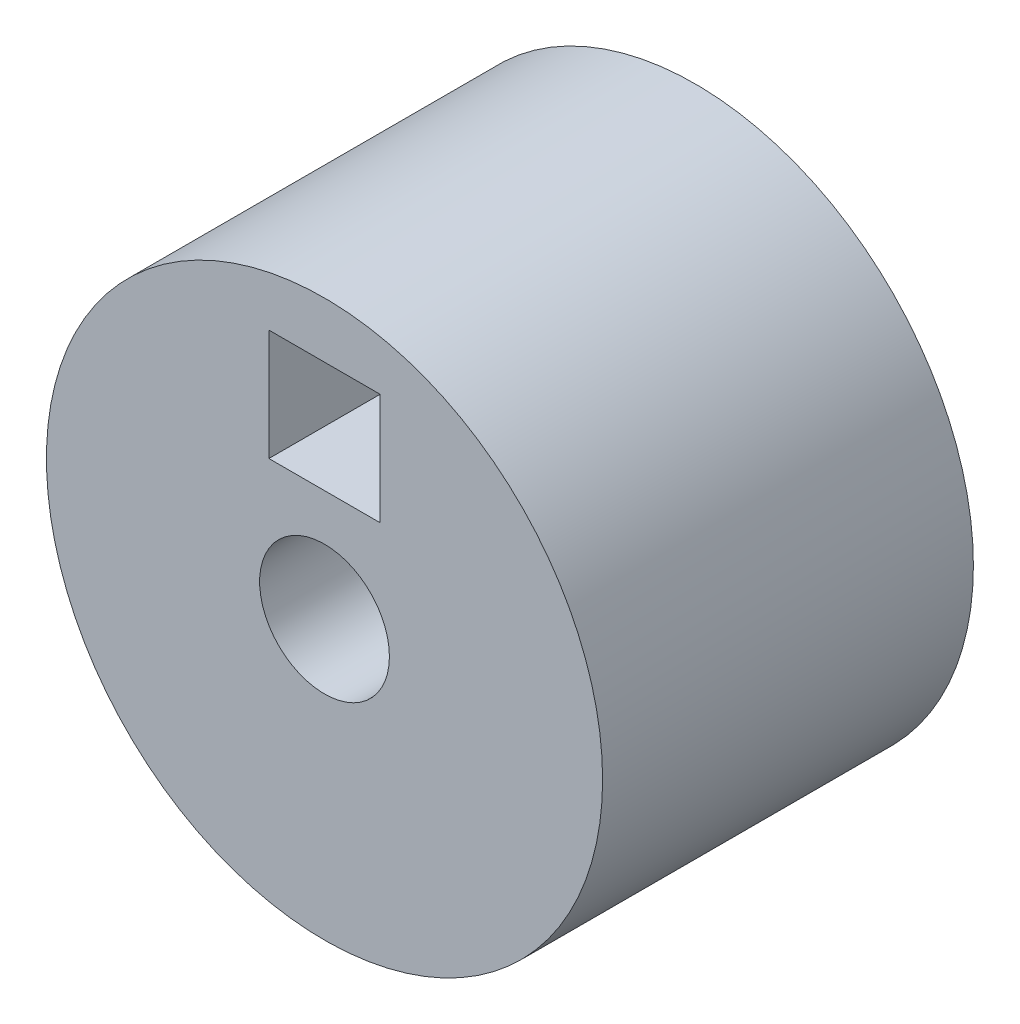
from build123d import *

# Parameters (mm, degrees)
SKETCH1_R           = 7.5
SKETCH1_R_2         = 1.75
BOSS_EXTRUDE1_DEPTH = 10
SKETCH2_W           = 3
SKETCH2_H           = 3
CUT_EXTRUDE1_DEPTH  = 15.577379737


with BuildPart() as part:
    # Sketch1 → Boss-Extrude1 (new body)
    with BuildSketch(Plane.XY):
        Circle(SKETCH1_R)
        Circle(SKETCH1_R_2, mode=Mode.SUBTRACT)
    extrude(amount=BOSS_EXTRUDE1_DEPTH)

    # Sketch2 → Cut-Extrude1 (cut, through all)
    with BuildSketch(Plane(origin=(0, 0, 0), x_dir=(-1, 0, 0), z_dir=(0, 0, -1))):
        with Locations((0, 4.5)):
            Rectangle(SKETCH2_W, SKETCH2_H)
    extrude(amount=-CUT_EXTRUDE1_DEPTH, mode=Mode.SUBTRACT)


solid = part.part
